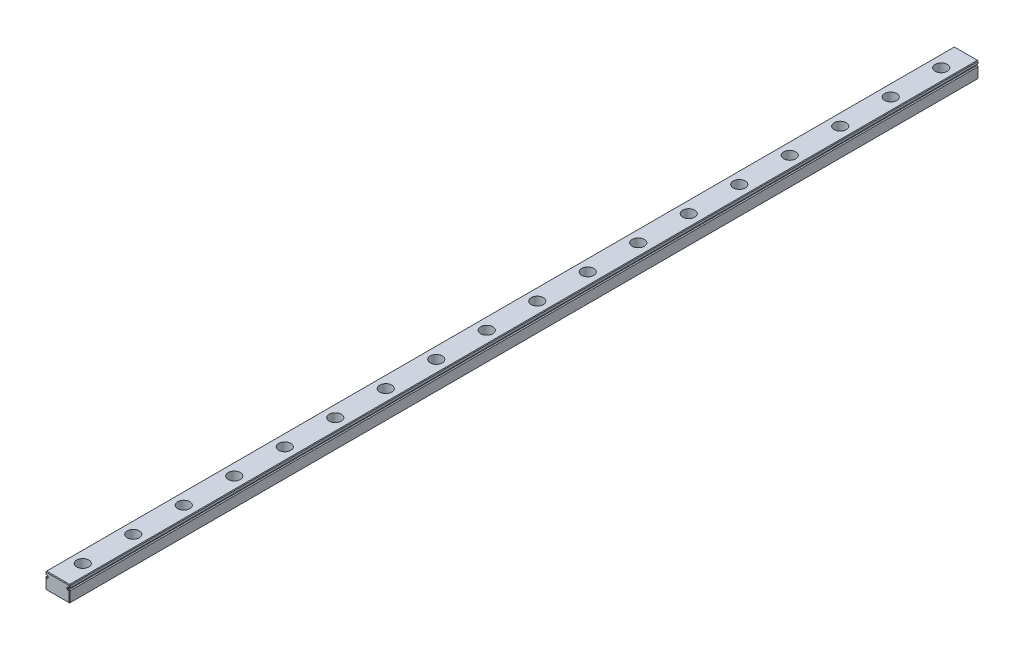
from build123d import *

# Parameters (mm, degrees)
BOSS_EXTRUDE1_DEPTH                     = 450
CHAMFER1_SIZE                           = 0.3
CBORE_FOR_M5_HEX_HEAD_BOLT1_D           = 3.5
CBORE_FOR_M5_HEX_HEAD_BOLT1_CBORE_D     = 6
CBORE_FOR_M5_HEX_HEAD_BOLT1_CBORE_DEPTH = 4.5
LPATTERN1_COUNT                         = 18
LPATTERN1_PITCH                         = 25


with BuildPart() as part:
    # Sketch1 → Boss-Extrude1 (new body)
    with BuildSketch(Plane.XY):
        with BuildLine():
            Line((0, 8), (12, 8))
            Line((12, 8), (12, 6.75))
            Line((12, 6.75), (12, 6.559016994))
            ThreePointArc((12, 6.559016994), (11.706107374, 6.475528258), (11.5, 6.25))
            Line((11.5, 6.25), (11, 6.25))
            Line((11, 6.25), (11, 5.75))
            Line((11, 5.75), (11.5, 5.75))
            ThreePointArc((11.5, 5.75), (11.706107374, 5.524471742), (12, 5.440983006))
            Line((12, 5.440983006), (12, 5.25))
            Line((12, 5.25), (12, 0))
            Line((12, 0), (0, 0))
            Line((0, 0), (0, 5.25))
            Line((0, 5.25), (0, 5.440983006))
            ThreePointArc((0, 5.440983006), (0.293892626, 5.524471742), (0.5, 5.75))
            Line((0.5, 5.75), (1, 5.75))
            Line((1, 5.75), (1, 6.25))
            Line((1, 6.25), (0.5, 6.25))
            ThreePointArc((0.5, 6.25), (0.293892626, 6.475528258), (0, 6.559016994))
            Line((0, 6.559016994), (0, 6.75))
            Line((0, 6.75), (0, 8))
        make_face()
    extrude(amount=BOSS_EXTRUDE1_DEPTH)

    # Chamfer1
    chamfer1_edges = [part.edges().sort_by_distance(p)[0] for p in [
        (12, 2.720491503, 450),
        (11.706107374, 5.524471742, 450),
        (0, 2.720491503, 0),
        (0.293892626, 5.524471742, 0),
        (0.75, 5.75, 0),
        (1, 6, 0),
        (0.75, 6.25, 0),
        (11.25, 5.75, 450),
        (0.293892626, 6.475528258, 0),
        (0, 7.279508497, 0),
        (6, 8, 0),
        (12, 7.279508497, 0),
        (11.706107374, 6.475528258, 0),
        (11, 6, 450),
        (11.25, 6.25, 0),
        (11, 6, 0),
        (11.25, 5.75, 0),
        (11.706107374, 5.524471742, 0),
        (12, 2.720491503, 0),
        (6, 0, 0),
        (11.25, 6.25, 450),
        (11.706107374, 6.475528258, 450),
        (12, 7.279508497, 450),
        (0, 8, 225),
        (12, 8, 225),
        (12, 0, 225),
        (0, 0, 225),
        (6, 8, 450),
        (0, 2.720491503, 450),
        (0, 7.279508497, 450),
        (0.293892626, 6.475528258, 450),
        (0.75, 6.25, 450),
        (1, 6, 450),
        (0.75, 5.75, 450),
        (0.293892626, 5.524471742, 450),
        (6, 0, 450),
    ]]
    chamfer(chamfer1_edges, length=CHAMFER1_SIZE)

    # CBORE for M5 Hex Head Bolt1 (through all)
    with Locations(Plane(origin=(6, 8, 12.5), x_dir=(0, 0, 1), z_dir=(0, 1, 0))):
        with Locations((0, 0)):
            cbore_for_m5_hex_head_bolt1 = CounterBoreHole(CBORE_FOR_M5_HEX_HEAD_BOLT1_D / 2, CBORE_FOR_M5_HEX_HEAD_BOLT1_CBORE_D / 2, CBORE_FOR_M5_HEX_HEAD_BOLT1_CBORE_DEPTH)

    # LPattern1: CBORE for M5 Hex Head Bolt1 ×18
    with Locations(*[(0, 0, i * LPATTERN1_PITCH) for i in range(1, LPATTERN1_COUNT)]):
        add(cbore_for_m5_hex_head_bolt1, mode=Mode.SUBTRACT)


solid = part.part
